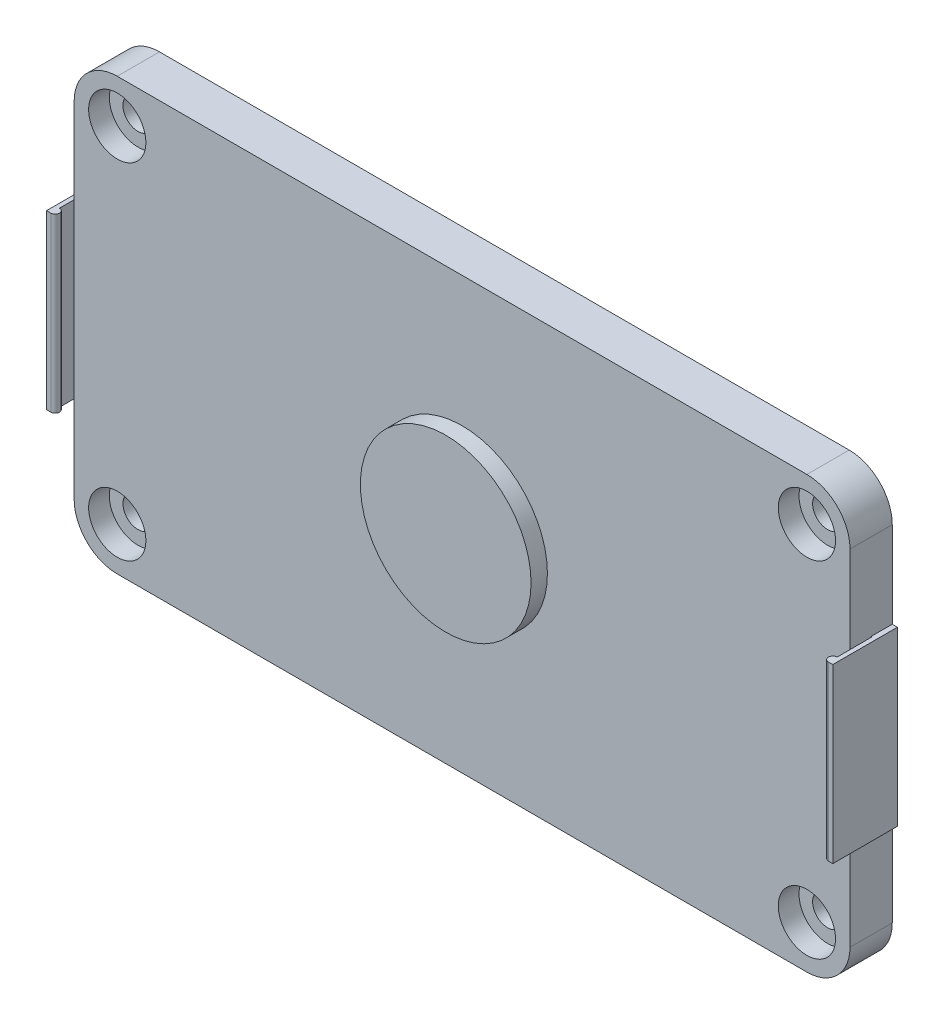
from build123d import *

# Parameters (mm, degrees)
SKETCH1_R           = 2.2098
BOSS_EXTRUDE1_DEPTH = 6.223
SKETCH2_R           = 4.2164
CUT_EXTRUDE1_DEPTH  = 3.048
SKETCH4_W           = 0.762
SKETCH4_H           = 25.4
BOSS_EXTRUDE2_DEPTH = 3.1115
BOSS_EXTRUDE3_DEPTH = 25.4
SKETCH6_R           = 12.573
BOSS_EXTRUDE4_DEPTH = 2.413


with BuildPart() as part:
    # Sketch1 → Boss-Extrude1 (new body)
    with BuildSketch(Plane.XY):
        with BuildLine():
            Line((-50.8, -31.75), (50.8, -31.75))
            ThreePointArc((50.8, -31.75), (55.290128061, -29.890128061), (57.15, -25.4))
            Line((57.15, -25.4), (57.15, 25.4))
            ThreePointArc((57.15, 25.4), (55.290128061, 29.890128061), (50.8, 31.75))
            Line((50.8, 31.75), (-50.8, 31.75))
            ThreePointArc((-50.8, 31.75), (-55.290128061, 29.890128061), (-57.15, 25.4))
            Line((-57.15, 25.4), (-57.15, -25.4))
            ThreePointArc((-57.15, -25.4), (-55.290128061, -29.890128061), (-50.8, -31.75))
        make_face()
        with Locations((-50.8, -25.4)):
            Circle(SKETCH1_R, mode=Mode.SUBTRACT)
        with Locations((-50.8, 25.4)):
            Circle(SKETCH1_R, mode=Mode.SUBTRACT)
        with Locations((50.8, 25.4)):
            Circle(SKETCH1_R, mode=Mode.SUBTRACT)
        with Locations((50.8, -25.4)):
            Circle(SKETCH1_R, mode=Mode.SUBTRACT)
    extrude(amount=BOSS_EXTRUDE1_DEPTH)

    # Sketch2 → Cut-Extrude1 (cut)
    with BuildSketch(Plane.XY.offset(6.223)):
        with Locations((-50.8, 25.4)):
            Circle(SKETCH2_R)
        with Locations((50.8, 25.4)):
            Circle(SKETCH2_R)
        with Locations((50.8, -25.4)):
            Circle(SKETCH2_R)
        with Locations((-50.8, -25.4)):
            Circle(SKETCH2_R)
    extrude(amount=-CUT_EXTRUDE1_DEPTH, mode=Mode.SUBTRACT)

    # Sketch4 → Boss-Extrude2 (add)
    with BuildSketch(Plane.XY):
        with Locations((-57.531, 0)):
            Rectangle(SKETCH4_W, SKETCH4_H)
        with Locations((57.531, 0)):
            Rectangle(SKETCH4_W, SKETCH4_H)
    extrude(amount=BOSS_EXTRUDE2_DEPTH)

    # Sketch5 → Boss-Extrude3 (add)
    with BuildSketch(Plane.XZ.offset(12.7)):
        with BuildLine():
            Line((-57.277, 3.1115), (-57.912, 3.1115))
            Line((-57.912, 3.1115), (-57.912, 9.525))
            Line((-57.912, 9.525), (-57.277, 9.525))
            ThreePointArc((-57.277, 9.525), (-56.642, 8.89), (-57.277, 8.255))
            Line((-57.277, 8.255), (-57.277, 3.1115))
        make_face()
        with BuildLine():
            Line((57.912, 9.525), (57.277, 9.525))
            ThreePointArc((57.277, 9.525), (56.642, 8.89), (57.277, 8.255))
            Line((57.277, 8.255), (57.277, 3.1115))
            Line((57.277, 3.1115), (57.912, 3.1115))
            Line((57.912, 3.1115), (57.912, 9.525))
        make_face()
    extrude(amount=-BOSS_EXTRUDE3_DEPTH)

    # Sketch6 → Boss-Extrude4 (add)
    with BuildSketch(Plane.XY.offset(6.223)):
        Circle(SKETCH6_R)
    extrude(amount=BOSS_EXTRUDE4_DEPTH)


solid = part.part
